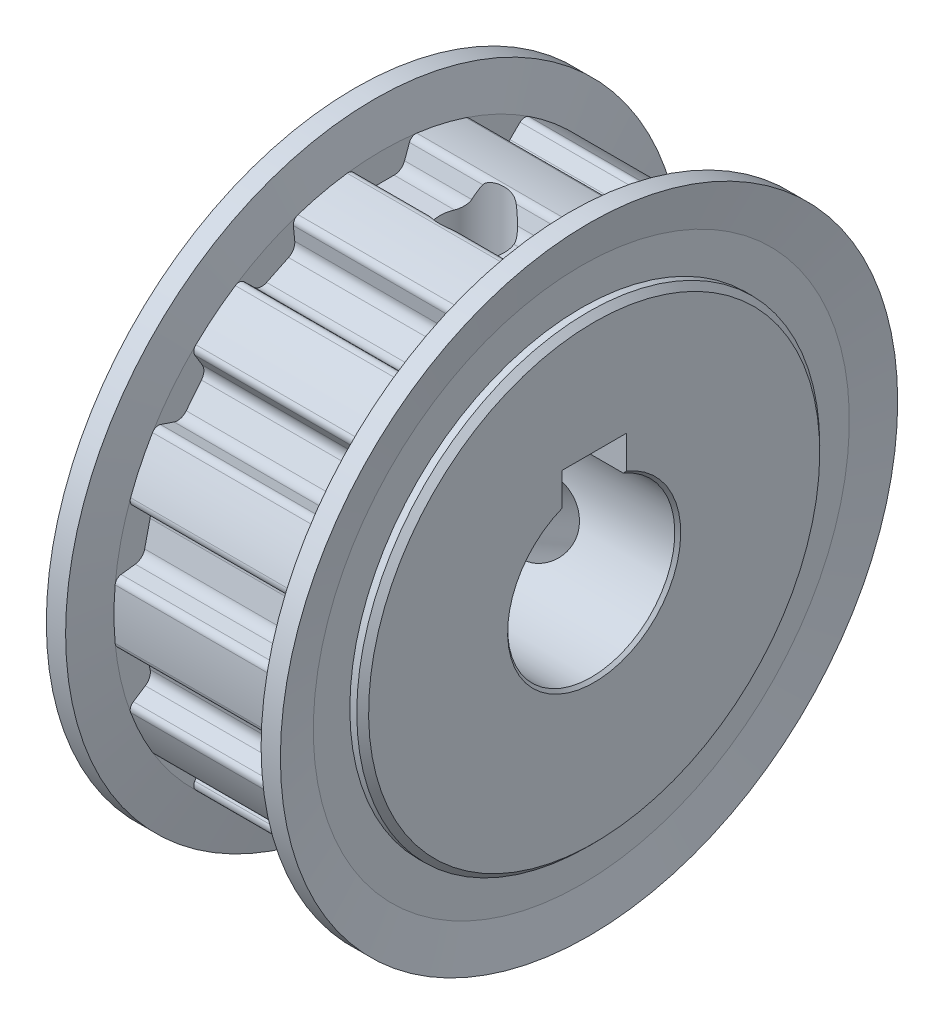
from build123d import *

# Parameters (mm, degrees)
CUT_EXTRUDE_START        = 16.5
CUT_EXTRUDE_1_DEPTH      = 14
PATTERN_CIRCULAR_1_COUNT = 14
SKETCH_6_R               = 6.5
CUT_EXTRUDE_2_DEPTH      = 39.897300678
CHAMFER_1_SIZE           = 0.23
SKETCH_7_W               = 5
SKETCH_7_H               = 2.8
CUT_EXTRUDE_1_2_DEPTH    = 19
SKETCH_11_W              = 2.5
SKETCH_11_H              = 20.84
PATTERN_CIRCULAR_2_COUNT = 2
PATTERN_CIRCULAR_2_ANGLE = 120


with BuildPart() as part:
    # 草图3 → 旋转1 (revolve)
    with BuildSketch(Plane.XY):
        Polygon((0, 0), (0, 17.54), (0.46, 18), (2.5, 18), (2.5, 20.84), (16.5, 20.84), (16.5, 18), (18.54, 18), (19, 17.54), (19, 0), align=None)
    revolve(axis=Axis((19, 0, 0), (-1, 0, 0)))

    # 草图4 → Cut-Extrude 1 (cut)
    with BuildSketch(Plane(origin=(0, 0, 0), x_dir=(0, 0, -1), z_dir=(1, 0, 0)).offset(CUT_EXTRUDE_START)):
        with BuildLine():
            Line((-0.947821517, 18.71), (0.947821517, 18.71))
            ThreePointArc((0.947821517, 18.71), (1.441097252, 18.865529242), (1.755957171, 19.275862677))
            Line((1.755957171, 19.275862677), (2.135902122, 20.319752849))
            ThreePointArc((2.135902122, 20.319752849), (2.358797616, 20.591469041), (2.702673222, 20.664006326))
            ThreePointArc((2.702673222, 20.664006326), (0, 20.84), (-2.702673222, 20.664006326))
            ThreePointArc((-2.702673222, 20.664006326), (-2.358797616, 20.591469041), (-2.135902122, 20.319752849))
            Line((-2.135902122, 20.319752849), (-1.755957171, 19.275862677))
            ThreePointArc((-1.755957171, 19.275862677), (-1.441097252, 18.865529242), (-0.947821517, 18.71))
        make_face()
    cut_extrude_1 = extrude(amount=-CUT_EXTRUDE_1_DEPTH, mode=Mode.SUBTRACT)

    # 阵列(圆周)1: Cut-Extrude 1 ×14 about axis
    pattern_circular_1_axis = Axis((0, 0, 0), (1, 0, 0))
    for i in range(1, PATTERN_CIRCULAR_1_COUNT):
        add(cut_extrude_1.rotate(pattern_circular_1_axis, i * 360 / PATTERN_CIRCULAR_1_COUNT), mode=Mode.SUBTRACT)

    # 草图5 → 旋转2 (revolve)
    with BuildSketch(Plane.XY, mode=Mode.PRIVATE) as revolve_2_sk:
        Polygon((1.9, 24), (2.5, 20.84), (2.5, 18), (1, 18), (1, 20.84), (0.4, 24), align=None)
        Polygon((18, 18), (16.5, 18), (16.5, 20.84), (17.1, 24), (18.6, 24), (18, 20.84), align=None)
    revolve(revolve_2_sk.sketch.rotate(Axis((0, 0, 0), (1, 0, 0)), 180), axis=Axis((0, 0, 0), (1, 0, 0)))

    # 草图6 → 切除-拉伸2 (cut, through all)
    with BuildSketch(Plane(origin=(0, 0, 0), x_dir=(0, 0, -1), z_dir=(1, 0, 0))):
        Circle(SKETCH_6_R)
    extrude(amount=CUT_EXTRUDE_2_DEPTH, mode=Mode.SUBTRACT)

    # 倒角1
    chamfer_1_edges = [part.edges().sort_by_distance(p)[0] for p in [
        (0, 0, 6.5),
        (19, 0, 6.5),
    ]]
    chamfer(chamfer_1_edges, length=CHAMFER_1_SIZE)

    # 草图7 → Cut-Extrude 1 2 (cut)
    with BuildSketch(Plane(origin=(0, 0, 0), x_dir=(0, 0, -1), z_dir=(1, 0, 0))):
        with Locations((0, 7.4)):
            Rectangle(SKETCH_7_W, SKETCH_7_H)
    extrude(amount=CUT_EXTRUDE_1_2_DEPTH, mode=Mode.SUBTRACT)

    # 草图11 → 切除-旋转5 (revolve, cut)
    with BuildSketch(Plane.XY, mode=Mode.PRIVATE) as cut_revolve_5_sk:
        with Locations((10.75, 10.42)):
            Rectangle(SKETCH_11_W, SKETCH_11_H)
    cut_revolve_5 = revolve(cut_revolve_5_sk.sketch.rotate(Axis((9.5, 20.84, 0), (0, -1, 0)), 157.720282995), axis=Axis((9.5, 20.84, 0), (0, -1, 0)), mode=Mode.SUBTRACT)

    # 阵列(圆周)2: 切除-旋转5 ×2 about axis
    pattern_circular_2_axis = Axis((19, 0, 0), (-1, 0, 0))
    for i in range(1, PATTERN_CIRCULAR_2_COUNT):
        add(cut_revolve_5.rotate(pattern_circular_2_axis, i * PATTERN_CIRCULAR_2_ANGLE / (PATTERN_CIRCULAR_2_COUNT - 1)), mode=Mode.SUBTRACT)


solid = part.part
